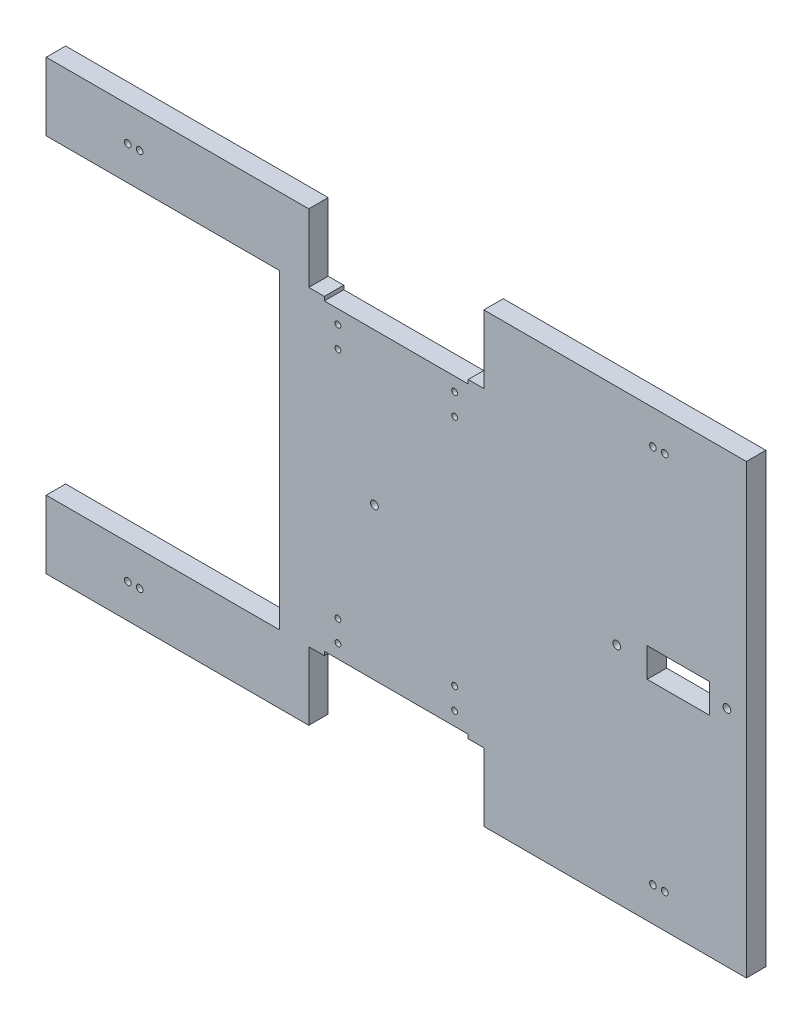
from build123d import *

# Parameters (mm, degrees)
SKETCH1_R           = 1.5
SKETCH1_R_2         = 1.7
SKETCH1_R_3         = 2
SKETCH1_W           = 32
SKETCH1_H           = 15
BOSS_EXTRUDE1_DEPTH = 10


with BuildPart() as part:
    # Sketch1 → Boss-Extrude1 (new body)
    with BuildSketch(Plane.XY):
        Polygon((-86.049704166, 116.333921241), (48.950295834, 116.333921241), (48.950295834, 81.333921241), (56.950295834, 81.333921241), (56.950295834, 79.313921241), (130.950295834, 79.313921241), (130.950295834, 81.333921241), (138.950295834, 81.333921241), (138.950295834, 116.333921241), (273.950295834, 116.333921241), (273.950295834, -113.666078759), (138.950295834, -113.666078759), (138.950295834, -78.666078759), (130.950295834, -78.666078759), (130.950295834, -76.646078759), (56.950295834, -76.646078759), (56.950295834, -78.666078759), (48.950295834, -78.666078759), (48.950295834, -113.666078759), (-86.049704166, -113.666078759), (-86.049704166, -78.666078759), (33.950295834, -78.666078759), (33.950295834, 81.333921241), (-86.049704166, 81.333921241), align=None)
        with Locations((63.950295834, 72.313921241)):
            Circle(SKETCH1_R, mode=Mode.SUBTRACT)
        with Locations((63.950295834, 61.313921241)):
            Circle(SKETCH1_R, mode=Mode.SUBTRACT)
        with Locations(Location((123.950295834, 72.313921241, 0), (0, 0, 180))):
            Circle(SKETCH1_R, mode=Mode.SUBTRACT)
        with Locations(Location((123.950295834, 61.313921241, 0), (0, 0, 180))):
            Circle(SKETCH1_R, mode=Mode.SUBTRACT)
        with Locations(Location((63.950295834, -69.646078759, 0), (0, 0, 180))):
            Circle(SKETCH1_R, mode=Mode.SUBTRACT)
        with Locations(Location((63.950295834, -58.646078759, 0), (0, 0, 180))):
            Circle(SKETCH1_R, mode=Mode.SUBTRACT)
        with Locations((123.950295834, -69.646078759)):
            Circle(SKETCH1_R, mode=Mode.SUBTRACT)
        with Locations((123.950295834, -58.646078759)):
            Circle(SKETCH1_R, mode=Mode.SUBTRACT)
        with Locations((-44.099704166, -96.166078759)):
            Circle(SKETCH1_R_2, mode=Mode.SUBTRACT)
        with Locations(Location((-37.999704166, -96.166078759, 0), (0, 0, 180))):
            Circle(SKETCH1_R_2, mode=Mode.SUBTRACT)
        with Locations(Location((-44.099704166, 98.833921241, 0), (0, 0, 180))):
            Circle(SKETCH1_R_2, mode=Mode.SUBTRACT)
        with Locations((-37.999704166, 98.833921241)):
            Circle(SKETCH1_R_2, mode=Mode.SUBTRACT)
        with Locations(Location((232.000295834, -96.166078759, 0), (0, 0, 180))):
            Circle(SKETCH1_R_2, mode=Mode.SUBTRACT)
        with Locations((225.900295834, -96.166078759)):
            Circle(SKETCH1_R_2, mode=Mode.SUBTRACT)
        with Locations(Location((225.900295834, 98.833921241, 0), (0, 0, 180))):
            Circle(SKETCH1_R_2, mode=Mode.SUBTRACT)
        with Locations((232.000295834, 98.833921241)):
            Circle(SKETCH1_R_2, mode=Mode.SUBTRACT)
        with Locations((82.718725704, 1.333921241)):
            Circle(SKETCH1_R_3, mode=Mode.SUBTRACT)
        with Locations((207.29497673, 1.333921241)):
            Circle(SKETCH1_R_3, mode=Mode.SUBTRACT)
        with Locations((263.950295834, 1.333921241)):
            Circle(SKETCH1_R_3, mode=Mode.SUBTRACT)
        with Locations((238.950295834, 1.333921241)):
            Rectangle(SKETCH1_W, SKETCH1_H, mode=Mode.SUBTRACT)
    extrude(amount=BOSS_EXTRUDE1_DEPTH)


solid = part.part
